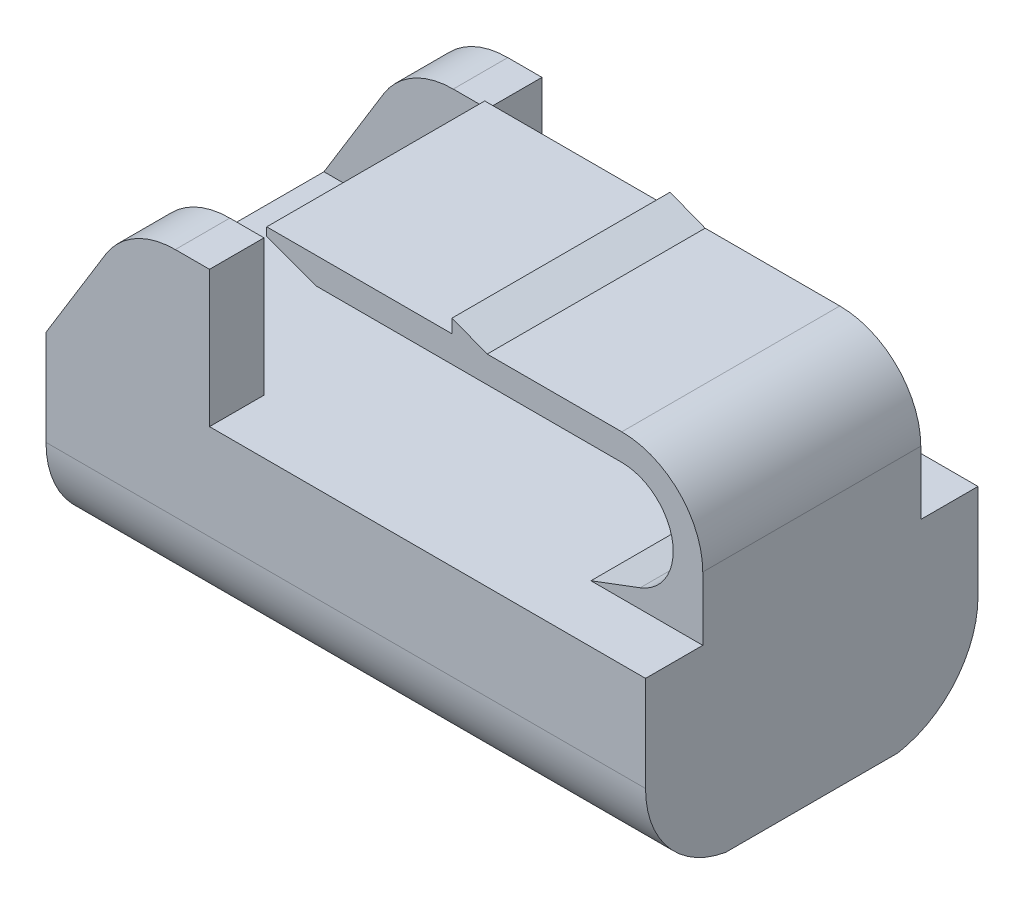
from build123d import *

# Parameters (mm, degrees)
SKETCH1_W                = 22
SKETCH1_H                = 12.2
BOSS_EXTRUDE1_DEPTH      = 7
CUT_EXTRUDE2_REACH       = 28.112
BOSS_EXTRUDE2_DEPTH      = 2
BOSS_EXTRUDE3_DEPTH      = 4
BOSS_EXTRUDE3_DEPTH_BACK = 4


with BuildPart() as part:
    # Sketch1 → Boss-Extrude1 (new body)
    with BuildSketch(Plane(origin=(0, 0, 0), x_dir=(1, 0, 0), z_dir=(0, 1, 0))):
        with Locations((11, 6.1)):
            Rectangle(SKETCH1_W, SKETCH1_H)
    extrude(amount=BOSS_EXTRUDE1_DEPTH)

    # Sketch2 → Cut-Extrude2 (cut, up to next)
    with BuildSketch(Plane(origin=(22, 0, 0), x_dir=(0, 0, -1), z_dir=(1, 0, 0)), mode=Mode.PRIVATE) as cut_extrude2_sk1:
        with BuildLine():
            Line((0, 3.5), (0, 0))
            Line((0, 0), (2.94128103, 0))
            ThreePointArc((2.94128103, 0), (0.832956575, 1.214112093), (0, 3.5))
        make_face()
    cut_extrude2_tool1 = extrude(cut_extrude2_sk1.sketch, amount=-CUT_EXTRUDE2_REACH, mode=Mode.PRIVATE) & part.part
    cut_extrude2 = cut_extrude2_tool1.solids().sort_by_distance((22, 0.790971, -0.742315))[0]
    add(cut_extrude2, mode=Mode.SUBTRACT)

    # Sketch3 → Boss-Extrude2 (add)
    with BuildSketch(Plane(origin=(0, 0, -12.2), x_dir=(-1, 0, 0), z_dir=(0, 0, -1))):
        with BuildLine():
            Line((0, 7), (-6, 7))
            Line((-6, 7), (-6, 12))
            Line((-6, 12), (-4.74458619, 12))
            ThreePointArc((-4.74458619, 12), (-3.278856211, 11.617562918), (-2.186825896, 10.567757085))
            Line((-2.186825896, 10.567757085), (0, 7))
        make_face()
    boss_extrude2 = extrude(amount=-BOSS_EXTRUDE2_DEPTH)

    # Mirror1: Cut-Extrude2, Boss-Extrude2 across plane
    add(cut_extrude2.mirror(Plane.XY.offset(-6.1)), mode=Mode.SUBTRACT)
    add(boss_extrude2.mirror(Plane.XY.offset(-6.1)))

    # Sketch4 → Boss-Extrude3 (add, two sides: drawn at the far end of the back side and taken through both)
    with BuildSketch(Plane.XY.offset(-6.1).offset(-BOSS_EXTRUDE3_DEPTH_BACK)):
        with BuildLine():
            Line((17.895721593, 7), (22, 7))
            Line((22, 7), (22, 9.329014645))
            ThreePointArc((22, 9.329014645), (21.129818536, 11.429818536), (19.029014645, 12.3))
            Line((19.029014645, 12.3), (14.087770897, 12.3))
            Line((14.087770897, 12.3), (12.8, 12.8))
            Line((12.8, 12.8), (12.8, 12.3))
            Line((12.8, 12.3), (6, 12.3))
            Line((6, 12.3), (6, 12))
            Line((6, 12), (7.815685998, 11.327241441))
            Line((7.815685998, 11.327241441), (19.029014645, 11.327241441))
            ThreePointArc((19.029014645, 11.327241441), (20.883632789, 9.783815259), (19.702745838, 7.679705271))
            Line((19.702745838, 7.679705271), (17.895721593, 7))
        make_face()
    extrude(amount=BOSS_EXTRUDE3_DEPTH + BOSS_EXTRUDE3_DEPTH_BACK)


solid = part.part
